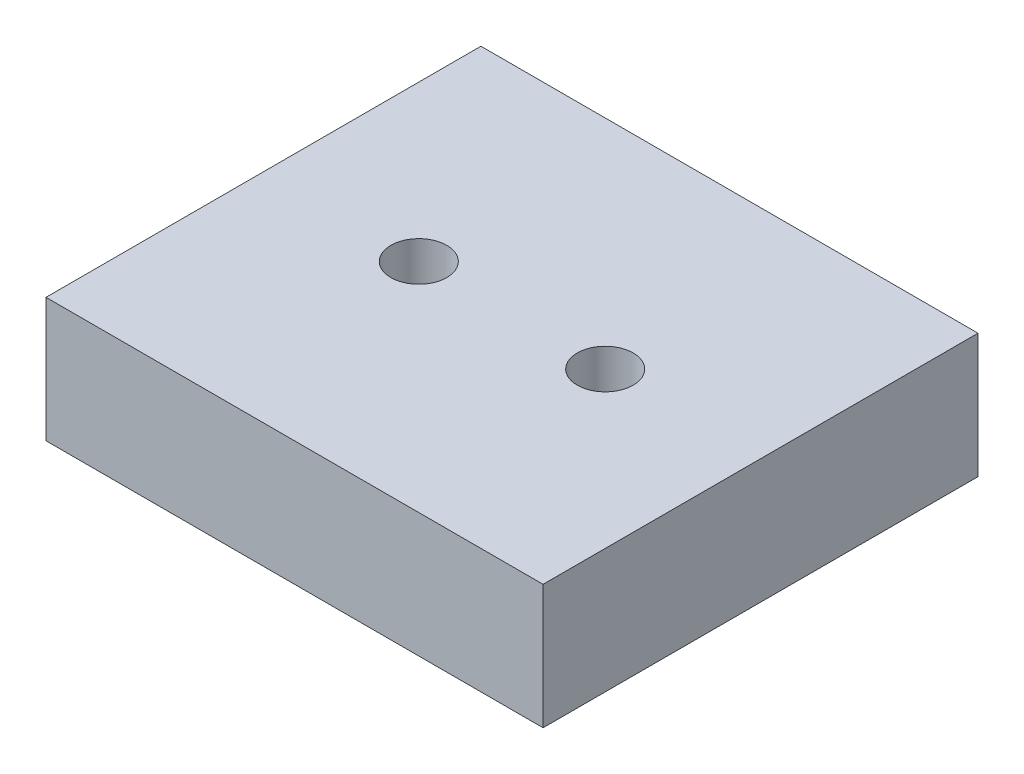
from build123d import *

# Parameters (mm, degrees)
SKETCH1_W           = 40
SKETCH1_H           = 35
BOSS_EXTRUDE1_DEPTH = 10
F_3DSKETCH1_R       = 2.25
CUT_EXTRUDE1_DEPTH  = 5
F_3DSKETCH2_R       = 5
CUT_EXTRUDE2_DEPTH  = 5


with BuildPart() as part:
    # Sketch1 → Boss-Extrude1 (new body)
    with BuildSketch(Plane(origin=(0, 0, 0), x_dir=(1, 0, 0), z_dir=(0, 1, 0))):
        Rectangle(SKETCH1_W, SKETCH1_H)
    extrude(amount=BOSS_EXTRUDE1_DEPTH)

    # 3DSketch1 → Cut-Extrude1 (cut)
    with BuildSketch(Plane(origin=(-7.5, 10, 0), x_dir=(1, 0, 0), z_dir=(0, -1, 0))):
        with Locations(Location((0, 0, 0), (0, 0, 90))):
            Circle(F_3DSKETCH1_R)
        with Locations(Location((15, 0, 0), (0, 0, 90))):
            Circle(F_3DSKETCH1_R)
    extrude(amount=CUT_EXTRUDE1_DEPTH, mode=Mode.SUBTRACT)

    # 3DSketch2 → Cut-Extrude2 (cut)
    with BuildSketch(Plane(origin=(-7.5, 0, 0), x_dir=(1, 0, 0), z_dir=(0, -1, 0))):
        with Locations(Location((0, 0, 0), (0, 0, 90))):
            Circle(F_3DSKETCH2_R)
        with Locations(Location((15, 0, 0), (0, 0, 90))):
            Circle(F_3DSKETCH2_R)
    extrude(amount=-CUT_EXTRUDE2_DEPTH, mode=Mode.SUBTRACT)


solid = part.part
